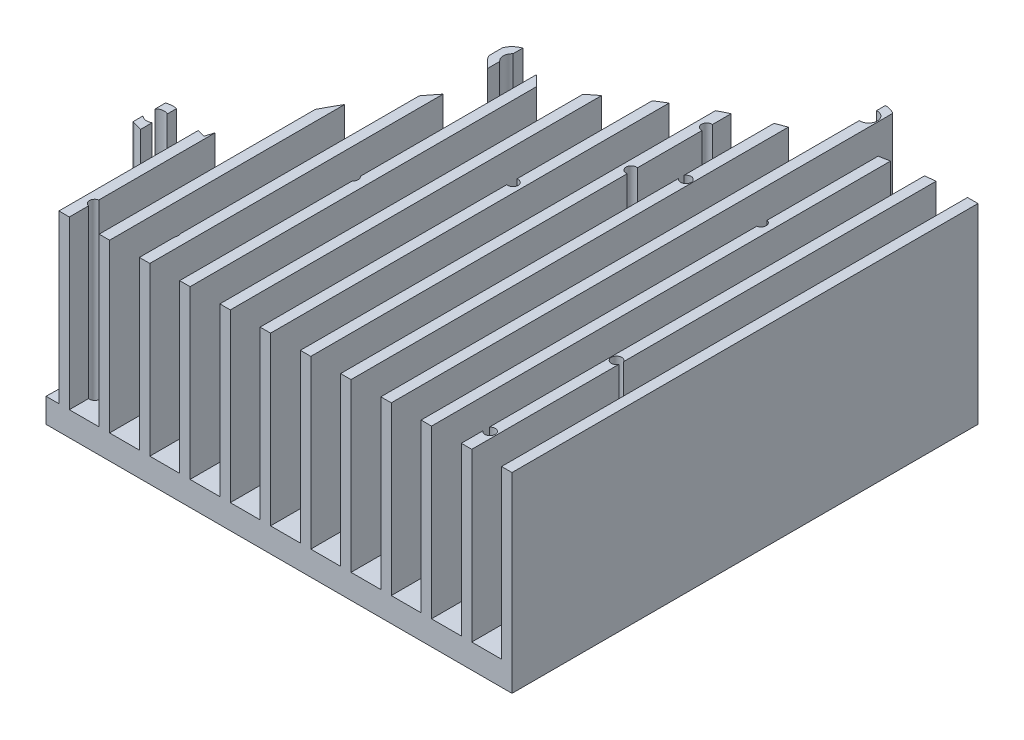
from build123d import *

# Parameters (mm, degrees)
BOSS_EXTRUDE1_DEPTH = 1000
CUT_EXTRUDE3_DEPTH  = 100
SKETCH3_6_R         = 1.5
SKETCH3_6_R_2       = 2.5
SKETCH3_6_R_3       = 1.501016752
CUT_EXTRUDE4_DEPTH  = 100


with BuildPart() as part:
    # Sketch1 → Boss-Extrude1 (new body)
    with BuildSketch(Plane.XY):
        Polygon((11.571428571, 55), (11.571428571, 7), (3, 7), (3, 55), (0, 55), (0, 7), (0, 0), (165, 0), (165, 7), (165, 10), (165, 55), (162, 55), (162, 7), (153.428571429, 7), (153.428571429, 55), (150.428571429, 55), (150.428571429, 7), (141.857142857, 7), (141.857142857, 55), (138.857142857, 55), (138.857142857, 7), (130.285714286, 7), (130.285714286, 55), (127.285714286, 55), (127.285714286, 7), (118.714285714, 7), (118.714285714, 55), (115.714285714, 55), (115.714285714, 7), (107.142857143, 7), (107.142857143, 55), (104.142857143, 55), (104.142857143, 7), (95.571428571, 7), (95.571428571, 55), (92.571428571, 55), (92.571428571, 7), (84, 7), (84, 55), (81, 55), (81, 7), (72.428571429, 7), (72.428571429, 55), (69.428571429, 55), (69.428571429, 7), (60.857142857, 7), (60.857142857, 55), (57.857142857, 55), (57.857142857, 7), (49.285714286, 7), (49.285714286, 55), (46.285714286, 55), (46.285714286, 7), (37.714285714, 7), (37.714285714, 55), (34.714285714, 55), (34.714285714, 7), (26.142857143, 7), (26.142857143, 55), (23.142857143, 55), (23.142857143, 7), (14.571428571, 7), (14.571428571, 55), align=None)
    extrude(amount=BOSS_EXTRUDE1_DEPTH)

    # Sketch3 → Cut-Extrude3 (cut)
    with BuildSketch(Plane.XZ):
        with BuildLine():
            Line((135.172029065, 203.361980458), (132.300867592, 192.646659963))
            ThreePointArc((132.300867592, 192.646659963), (126.177143235, 189.111126057), (122.641609329, 195.234850414))
            Line((122.641609329, 195.234850414), (125.512770802, 205.950170909))
            ThreePointArc((125.512770802, 205.950170909), (98, 217.952595893), (73.849209656, 235.778141844))
            Line((73.849209656, 235.778141844), (66.005050634, 227.933982822))
            ThreePointArc((66.005050634, 227.933982822), (58.933982822, 227.933982822), (58.933982822, 235.005050634))
            Line((58.933982822, 235.005050634), (66.778141844, 242.849209656))
            ThreePointArc((66.778141844, 242.849209656), (48.952595893, 267), (36.950170909, 294.512770802))
            Line((36.950170909, 294.512770802), (26.234850414, 291.641609329))
            ThreePointArc((26.234850414, 291.641609329), (20.111126057, 295.177143235), (23.646659963, 301.300867592))
            Line((23.646659963, 301.300867592), (34.361980458, 304.172029065))
            ThreePointArc((34.361980458, 304.172029065), (31.843147719, 318.991579341), (31, 334))
            Line((31, 334), (165, 334))
            Line((165, 334), (165, 1000))
            Line((165, 1000), (0, 1000))
            Line((0, 1000), (0, 0))
            Line((0, 0), (165, 0))
            Line((165, 0), (165, 200))
            ThreePointArc((165, 200), (149.991579341, 200.843147719), (135.172029065, 203.361980458))
        make_face()
    extrude(amount=-CUT_EXTRUDE3_DEPTH, mode=Mode.SUBTRACT)

    # Sketch3<6> → Cut-Extrude4 (cut)
    with BuildSketch(Plane.XZ):
        with Locations(Location((117, 236, 0), (0, 0, 270))):
            Circle(SKETCH3_6_R)
        with Locations(Location((106.834, 241.544, 0), (0, 0, 270))):
            Circle(SKETCH3_6_R)
        with Locations(Location((127.47123846, 193.940755188, 0), (0, 0, 270))):
            Circle(SKETCH3_6_R_2)
        with Locations(Location((62.469516728, 231.469516728, 0), (0, 0, 270))):
            Circle(SKETCH3_6_R_2)
        with Locations(Location((24.940755188, 296.47123846, 0), (0, 0, 270))):
            Circle(SKETCH3_6_R_2)
        with Locations(Location((159, 206, 0), (0, 0, 270))):
            Circle(SKETCH3_6_R)
        with Locations(Location((159.945, 224.958, 0), (0, 0, 270))):
            Circle(SKETCH3_6_R)
        with Locations(Location((138.59, 236, 0), (0, 0, 270))):
            Circle(SKETCH3_6_R)
        with Locations(Location((107, 220, 0), (0, 0, 270))):
            Circle(SKETCH3_6_R)
        with Locations(Location((92.864, 261.61, 0), (0, 0, 270))):
            Circle(SKETCH3_6_R)
        with Locations(Location((74.576, 273.548, 0), (0, 0, 270))):
            Circle(SKETCH3_6_R)
        with Locations(Location((68.48, 283.2, 0), (0, 0, 270))):
            Circle(SKETCH3_6_R)
        with Locations(Location((51, 276, 0), (0, 0, 270))):
            Circle(SKETCH3_6_R)
        with Locations(Location((152.097, 291.028, 0), (0, 0, 270))):
            Circle(SKETCH3_6_R)
        with Locations(Location((133.3, 304.5, 0), (0, 0, 270))):
            Circle(SKETCH3_6_R)
        with Locations(Location((66.702, 306.822, 0), (0, 0, 270))):
            Circle(SKETCH3_6_R)
        with Locations(Location((56.542, 323.078, 0), (0, 0, 270))):
            Circle(SKETCH3_6_R)
        with Locations(Location((38, 327, 0), (0, 0, 270))):
            Circle(SKETCH3_6_R)
        with Locations(Location((124, 325, 0), (0, 0, 270))):
            Circle(SKETCH3_6_R)
        with Locations(Location((158, 321, 0), (0, 0, 270))):
            Circle(SKETCH3_6_R_3)
        with Locations(Location((151.6, 326.9, 0), (0, 0, 270))):
            Circle(SKETCH3_6_R)
    extrude(amount=-CUT_EXTRUDE4_DEPTH, mode=Mode.SUBTRACT)


solid = part.part
